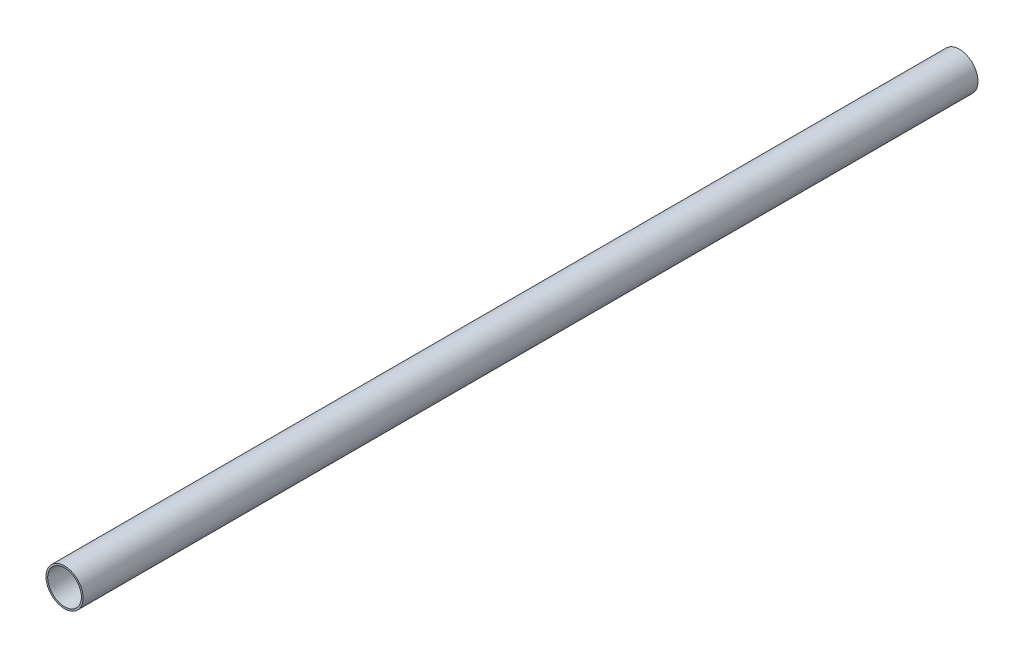
from build123d import *

# Parameters (mm, degrees)
ESQUISSE1_R                  = 19.2405
ESQUISSE1_R_2                = 17.4625
BOSS_EXTRU_1_DEPTH           = 965.2
ENL_V_MAT_EXTRU_1_DEPTH      = 966.583468003
ENL_V_MAT_EXTRU_1_DEPTH_BACK = 966.583468003
ESQUISSE2_W                  = 38.481
ESQUISSE2_H                  = 38.1


with BuildPart() as part:
    # Esquisse1 → Boss.-Extru.1 (new body)
    with BuildSketch(Plane.XY):
        Circle(ESQUISSE1_R)
        Circle(ESQUISSE1_R_2, mode=Mode.SUBTRACT)
    extrude(amount=BOSS_EXTRU_1_DEPTH)

    # Esquisse2 → Enlèv. mat.-Extru.1 (cut, two sides: drawn at the far end of the back side and taken through both)
    with BuildSketch(Plane(origin=(0, 0, 0), x_dir=(1, 0, 0), z_dir=(0, 1, 0)).offset(-ENL_V_MAT_EXTRU_1_DEPTH_BACK)):
        with Locations((0, -19.05)):
            Rectangle(ESQUISSE2_W, ESQUISSE2_H)
    extrude(amount=ENL_V_MAT_EXTRU_1_DEPTH + ENL_V_MAT_EXTRU_1_DEPTH_BACK, mode=Mode.SUBTRACT)


solid = part.part
